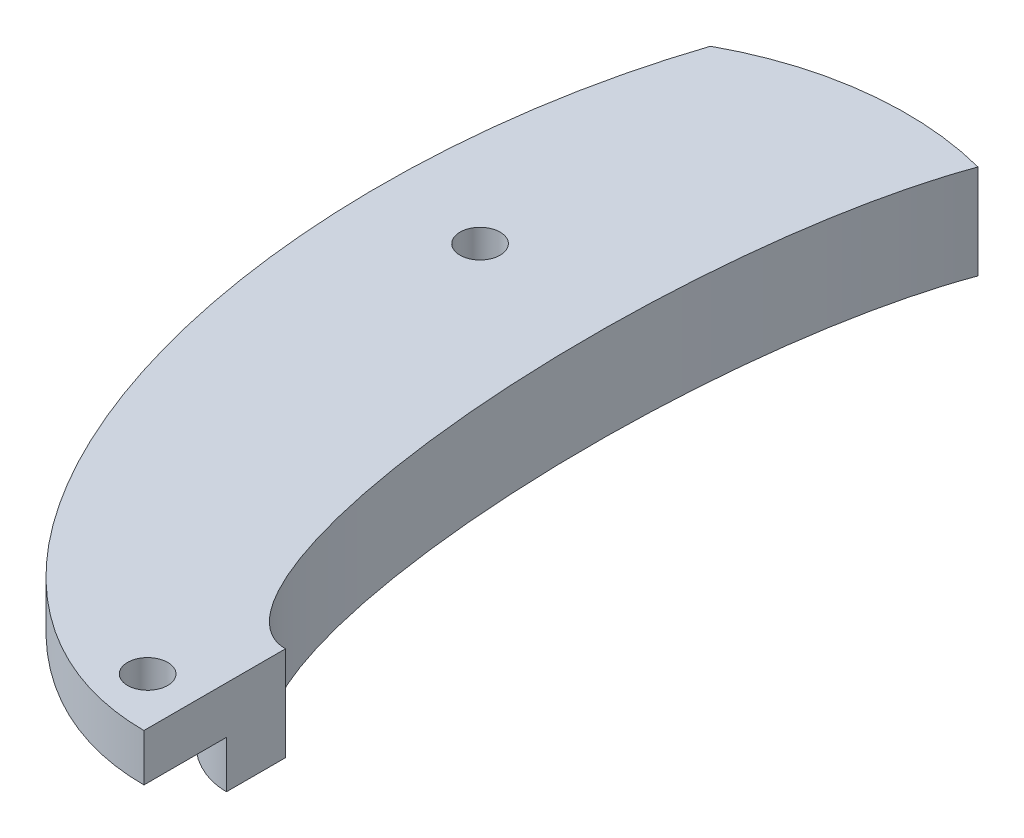
from build123d import *

# Parameters (mm, degrees)
SKETCH_1_R      = 1.7
EXTRUDE_1_DEPTH = 4
EXTRUDE_START   = -8
EXTRUDE_2_DEPTH = 8


with BuildPart() as part:
    # Эскиз1 → Бобышка-Вытянуть1 (new body)
    with BuildSketch(Plane(origin=(0, 0, 0), x_dir=(1, 0, 0), z_dir=(0, 1, 0))):
        with BuildLine():
            Line((0, -50), (0, -43))
            add(Edge.make_bspline(
                [(-10.000145873, 27.475174978), (-27.697978685, -43), (0, -43)],
                knots=[4.019246634, 4.019246634, 4.019246634, 6.283185307, 6.283185307, 6.283185307], degree=2, weights=[1, 0.42487789, 1]))
            ThreePointArc((-10.000145873, 27.475174978), (-18.360814479, 27.113576543), (-26.230013338, 24.266254592))
            add(Edge.make_bspline(
                [(-26.230013338, 24.266254592), (-50.964235719, -50), (0, -50)],
                knots=[4.205654034, 4.205654034, 4.205654034, 6.283185307, 6.283185307, 6.283185307], degree=2, weights=[1, 0.507284392, 1]))
        make_face()
        with Locations(Location((-3.997292475, -45.689262056, 0), (0, 0, 270))):
            Circle(SKETCH_1_R, mode=Mode.SUBTRACT)
        with Locations(Location((-21.5, 0, 0), (0, 0, 270))):
            Circle(SKETCH_1_R, mode=Mode.SUBTRACT)
    extrude(amount=EXTRUDE_1_DEPTH)

    # Эскиз2 → Бобышка-Вытянуть2 (add)
    with BuildSketch(Plane(origin=(0, 4, 0), x_dir=(1, 0, 0), z_dir=(0, 1, 0)).offset(EXTRUDE_START)):
        with BuildLine():
            Line((0, -43), (0, -38))
            add(Edge.make_bspline(
                [(-6.021112225, 26.742839981), (-29.868438829, -38), (0, -38)],
                knots=[3.78773541, 3.78773541, 3.78773541, 6.283185307, 6.283185307, 6.283185307], degree=2, weights=[1, 0.317480533, 1]))
            ThreePointArc((-6.021112225, 26.742839981), (-8.200317768, 27.218512364), (-10.410783781, 27.516909787))
            add(Edge.make_bspline(
                [(-10.410783781, 27.516909787), (-37.171364773, -43), (0, -43)],
                knots=[3.908695263, 3.908695263, 3.908695263, 6.283185307, 6.283185307, 6.283185307], degree=2, weights=[1, 0.374216095, 1]))
        make_face()
    extrude(amount=EXTRUDE_2_DEPTH)


solid = part.part
